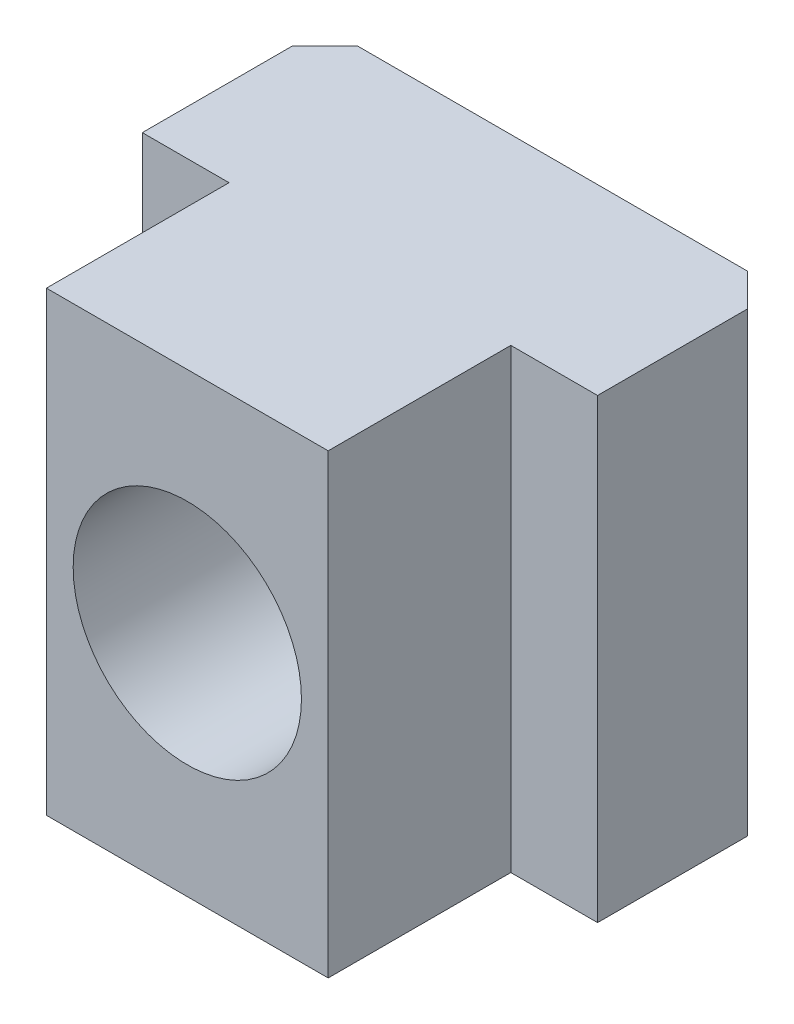
from build123d import *

# Parameters (mm, degrees)
BOSS_EXTRUDE1_DEPTH = 17.5
M20_TAPPED_HOLE1_D  = 17.5


with BuildPart() as part:
    # Sketch1 → Boss-Extrude1 (new, symmetric)
    with BuildSketch(Plane(origin=(0, 0, 0), x_dir=(1, 0, 0), z_dir=(0, 1, 0))):
        Polygon((-10.8, 0), (-17.45, 0), (-17.45, 11.5), (-14.95, 14), (14.95, 14), (17.45, 11.5), (17.45, 0), (10.8, 0), (10.8, -14), (-10.8, -14), align=None)
    extrude(amount=BOSS_EXTRUDE1_DEPTH, both=True)

    # M20 Tapped Hole1 (through all)
    with Locations(Plane.XY.offset(14)):
        with Locations((0, 0)):
            Hole(M20_TAPPED_HOLE1_D / 2)


solid = part.part
